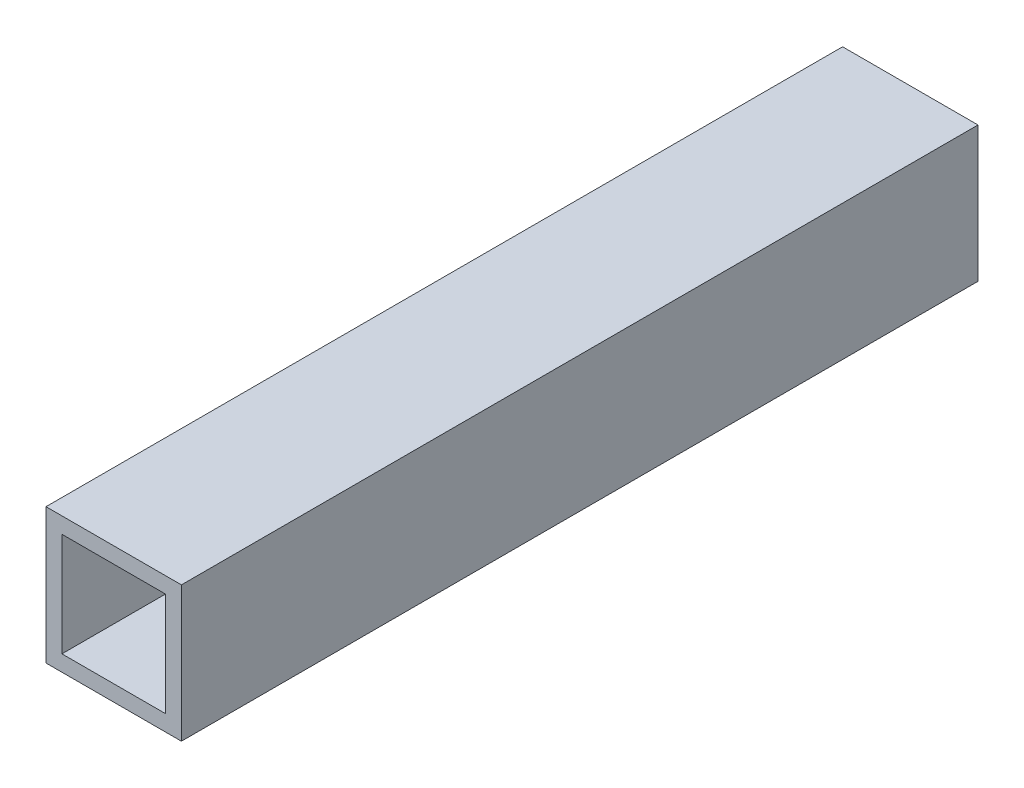
from build123d import *

# Parameters (mm, degrees)
SKETCH1_W           = 17
SKETCH1_H           = 17
SKETCH1_W_2         = 13
SKETCH1_H_2         = 13
BOSS_EXTRUDE1_DEPTH = 100


with BuildPart() as part:
    # Sketch1 → Boss-Extrude1 (new body)
    with BuildSketch(Plane.XY):
        Rectangle(SKETCH1_W, SKETCH1_H)
        Rectangle(SKETCH1_W_2, SKETCH1_H_2, mode=Mode.SUBTRACT)
    extrude(amount=BOSS_EXTRUDE1_DEPTH)


solid = part.part
